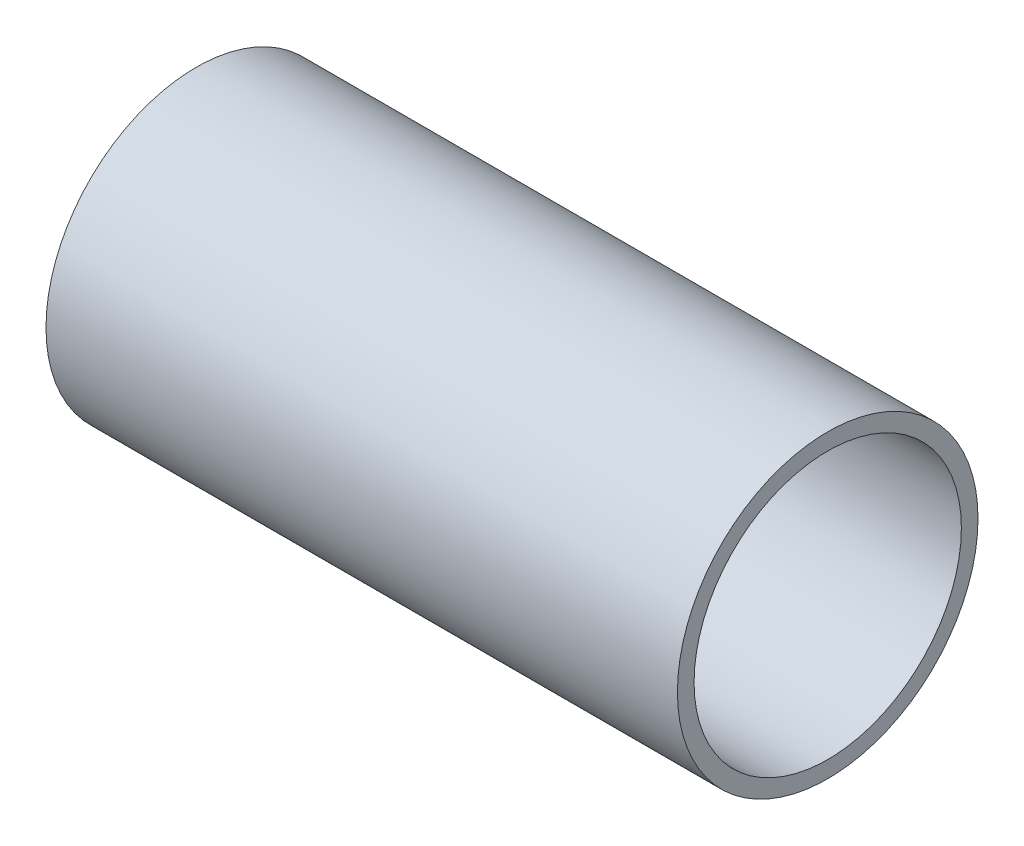
from build123d import *

# Parameters (mm, degrees)
SKETCH2_R           = 7.14
SKETCH2_R_2         = 6.35
BOSS_EXTRUDE1_DEPTH = 30


with BuildPart() as part:
    # Sketch2 → Boss-Extrude1 (new body)
    with BuildSketch(Plane(origin=(0, 0, 0), x_dir=(0, 0, -1), z_dir=(1, 0, 0))):
        Circle(SKETCH2_R)
        Circle(SKETCH2_R_2, mode=Mode.SUBTRACT)
    extrude(amount=BOSS_EXTRUDE1_DEPTH)


solid = part.part
